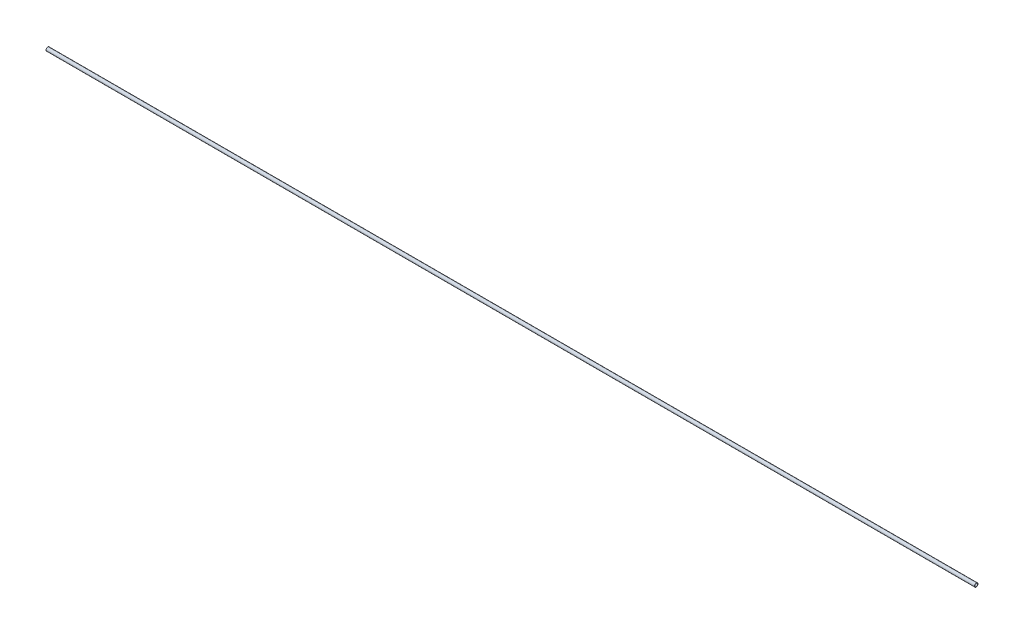
from build123d import *

# Parameters (mm, degrees)
CROQUIS1_R              = 19
CROQUIS1_R_2            = 15
SALIENTE_EXTRUIR1_DEPTH = 10000


with BuildPart() as part:
    # Croquis1 → Saliente-Extruir1 (new body)
    with BuildSketch(Plane(origin=(0, 0, 0), x_dir=(0, 0, -1), z_dir=(1, 0, 0))):
        Circle(CROQUIS1_R)
        Circle(CROQUIS1_R_2, mode=Mode.SUBTRACT)
    extrude(amount=SALIENTE_EXTRUIR1_DEPTH)


solid = part.part
